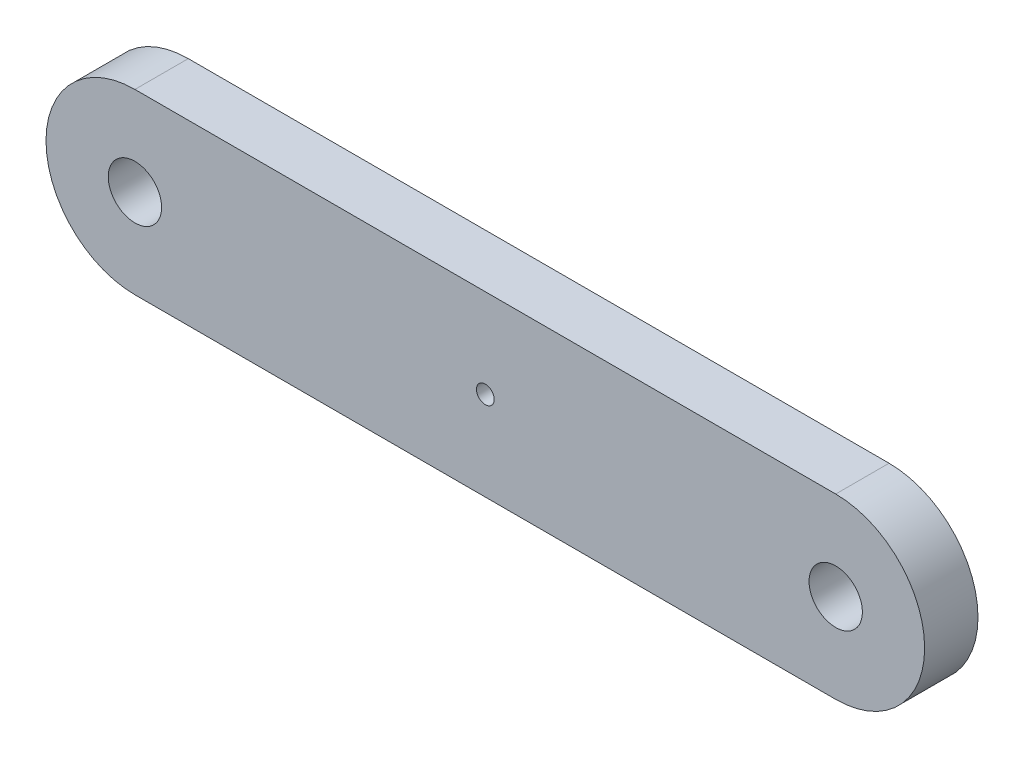
from build123d import *

# Parameters (mm, degrees)
SKETCH1_R           = 1.5
SKETCH1_R_2         = 0.5
BOSS_EXTRUDE1_DEPTH = 3


with BuildPart() as part:
    # Sketch1 → Boss-Extrude1 (new body)
    with BuildSketch(Plane.XY):
        with BuildLine():
            Line((0, 5), (39.4, 5))
            ThreePointArc((39.4, 5), (44.4, 0), (39.4, -5))
            Line((39.4, -5), (0, -5))
            ThreePointArc((0, -5), (-5, 0), (0, 5))
        make_face()
        Circle(SKETCH1_R, mode=Mode.SUBTRACT)
        with Locations((39.4, 0)):
            Circle(SKETCH1_R, mode=Mode.SUBTRACT)
        with Locations((19.7, 0)):
            Circle(SKETCH1_R_2, mode=Mode.SUBTRACT)
    extrude(amount=BOSS_EXTRUDE1_DEPTH)


solid = part.part
